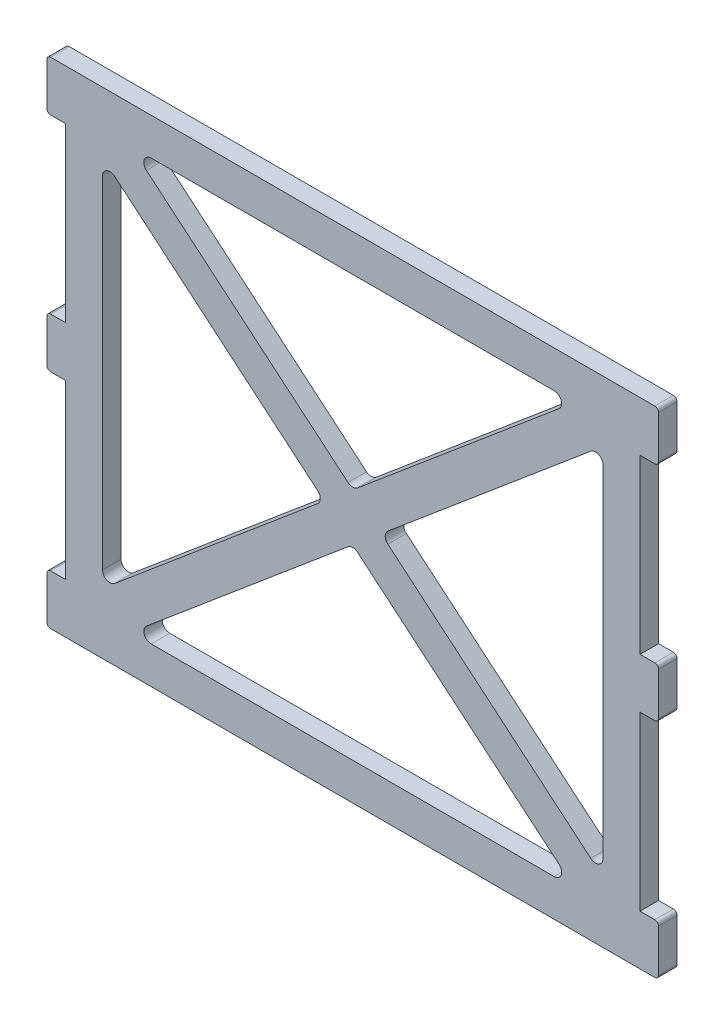
from build123d import *

# Parameters (mm, degrees)
SKETCH2_W           = 6.35
SKETCH2_H           = 17.145
BOSS_EXTRUDE1_DEPTH = 6.35
CUT_EXTRUDE1_DEPTH  = 135.924052271
FILLET1_R           = 2.54
FILLET2_R           = 1.27


with BuildPart() as part:
    # Sketch2 → Boss-Extrude1 (new body)
    with BuildSketch(Plane.XY):
        Polygon((98.425, 84.7725), (-98.425, 84.7725), (-98.425, 67.6275), (-98.425, 8.5725), (-98.425, -8.5725), (-98.425, -67.6275), (-98.425, -84.7725), (98.425, -84.7725), (98.425, -67.6275), (98.425, -8.5725), (98.425, 8.5725), (98.425, 67.6275), align=None)
        with Locations((-101.6, 76.2)):
            Rectangle(SKETCH2_W, SKETCH2_H)
        with Locations((-101.6, 0)):
            Rectangle(SKETCH2_W, SKETCH2_H)
        with Locations((101.6, 76.2)):
            Rectangle(SKETCH2_W, SKETCH2_H)
        with Locations((101.6, 0)):
            Rectangle(SKETCH2_W, SKETCH2_H)
        with Locations((101.6, -76.2)):
            Rectangle(SKETCH2_W, SKETCH2_H)
        with Locations((-101.6, -76.2)):
            Rectangle(SKETCH2_W, SKETCH2_H)
    extrude(amount=BOSS_EXTRUDE1_DEPTH)

    # Sketch3 → Cut-Extrude1 (cut, through all)
    with BuildSketch(Plane.XY.offset(6.35)):
        Polygon((-9.72090457, 0), (-85.725, 63.899739491), (-85.725, -63.899739491), align=None)
        Polygon((76.00409543, 72.0725), (-76.00409543, 72.0725), (0, 8.172760509), align=None)
        Polygon((85.725, -63.899739491), (85.725, 63.899739491), (9.72090457, 0), align=None)
        Polygon((0, -8.172760509), (-76.00409543, -72.0725), (76.00409543, -72.0725), align=None)
    extrude(amount=-CUT_EXTRUDE1_DEPTH, mode=Mode.SUBTRACT)

    # Fillet1
    fillet1_edges = [part.edges().sort_by_distance(p)[0] for p in [
        (85.725, 63.899739491, 3.175),
        (85.725, -63.899739491, 3.175),
        (9.72090457, 0, 3.175),
        (76.00409543, 72.0725, 3.175),
        (0, 8.172760509, 3.175),
        (-76.00409543, 72.0725, 3.175),
        (0, -8.172760509, 3.175),
        (76.00409543, -72.0725, 3.175),
        (-76.00409543, -72.0725, 3.175),
        (-9.72090457, 0, 3.175),
        (-85.725, -63.899739491, 3.175),
        (-85.725, 63.899739491, 3.175),
    ]]
    fillet(fillet1_edges, radius=FILLET1_R)

    # Fillet2
    fillet2_edges = [part.edges().sort_by_distance(p)[0] for p in [
        (104.775, 8.5725, 3.175),
        (104.775, -8.5725, 3.175),
        (104.775, -67.6275, 3.175),
        (104.775, -84.7725, 3.175),
        (-104.775, -8.5725, 3.175),
        (-104.775, 8.5725, 3.175),
        (-104.775, 67.6275, 3.175),
        (-104.775, 84.7725, 3.175),
        (104.775, 84.7725, 3.175),
        (104.775, 67.6275, 3.175),
        (-104.775, -67.6275, 3.175),
        (-104.775, -84.7725, 3.175),
    ]]
    fillet(fillet2_edges, radius=FILLET2_R)


solid = part.part
